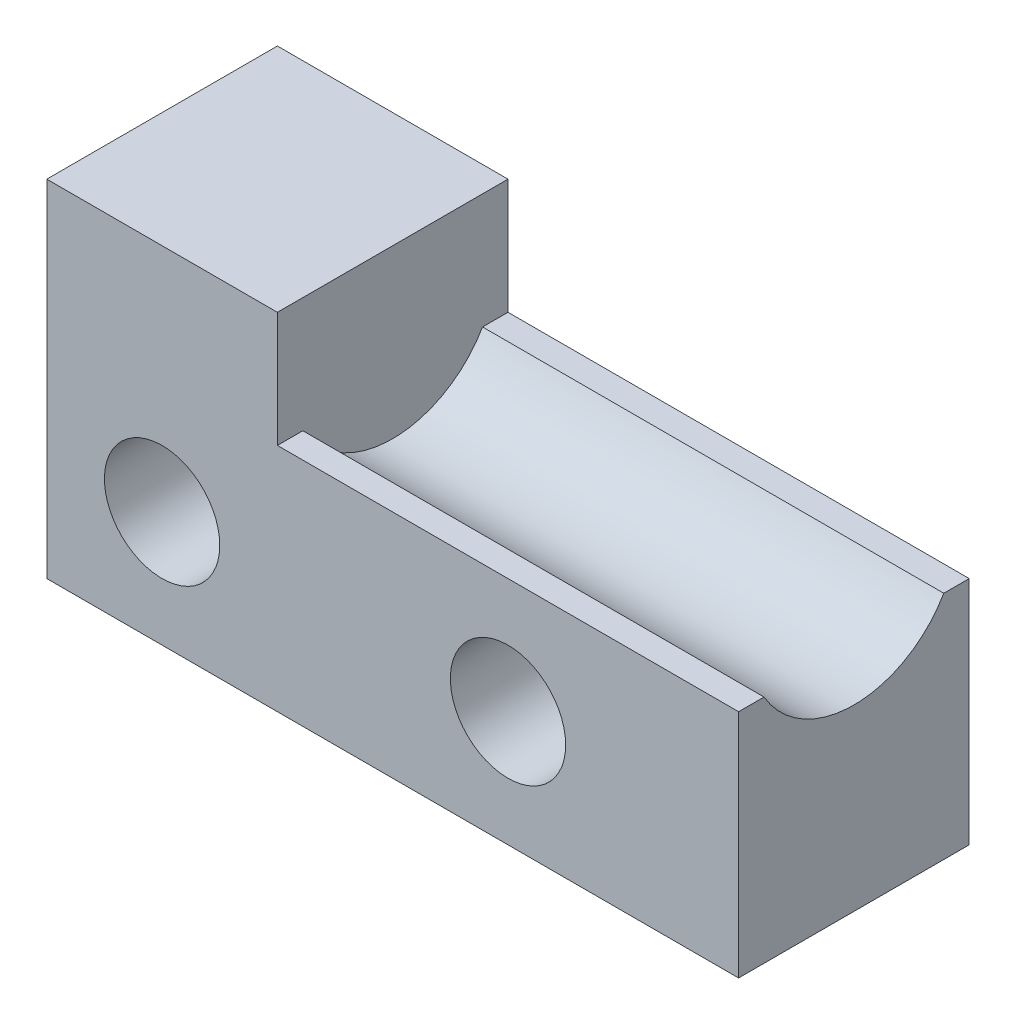
from build123d import *

# Parameters (mm, degrees)
SKETCH_1_R          = 2.5
EXTRUDE_1_DEPTH     = 10
SKETCH_2_R          = 4.5
CUT_EXTRUDE_2_DEPTH = 20


with BuildPart() as part:
    # 草圖1 → 填料-伸長1 (new body)
    with BuildSketch(Plane.XY):
        Polygon((0, 0), (0, 15), (10, 15), (10, 10), (30, 10), (30, 0), align=None)
        with Locations((5, 5)):
            Circle(SKETCH_1_R, mode=Mode.SUBTRACT)
        with Locations((20, 5)):
            Circle(SKETCH_1_R, mode=Mode.SUBTRACT)
    extrude(amount=EXTRUDE_1_DEPTH)

    # 草圖2 → 除料-伸長2 (cut)
    with BuildSketch(Plane(origin=(30, 0, 0), x_dir=(0, 0, -1), z_dir=(1, 0, 0))):
        with Locations((-5, 12.25)):
            Circle(SKETCH_2_R)
    extrude(amount=-CUT_EXTRUDE_2_DEPTH, mode=Mode.SUBTRACT)


solid = part.part
